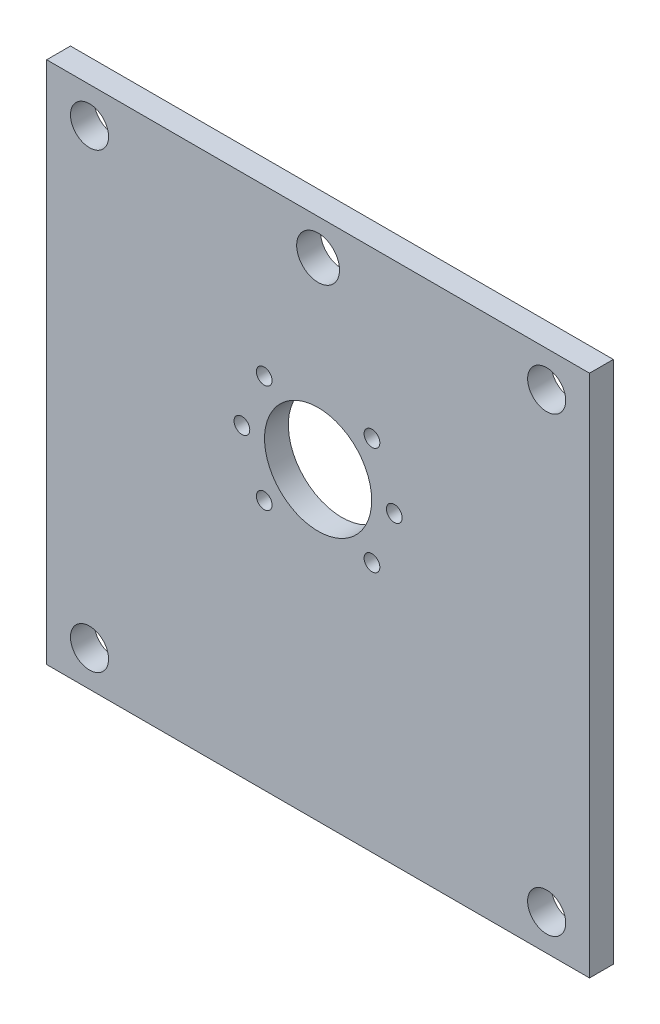
from build123d import *

# Parameters (mm, degrees)
SKETCH_1_W               = 114
SKETCH_1_H               = 110
SKETCH_1_R               = 11.25
EXTRUDE_1_DEPTH          = 5
SKETCH_2_R               = 4
CUT_EXTRUDE_1_DEPTH      = 80.366239674
MIRROR_2_COPY_1_SKETCH_R = 4
MIRROR_2_COPY_1_DEPTH    = 80.366239674
HOLE_WIZARD_M4_2_D       = 3.3
HOLE_WIZARD_M4_3_D       = 3.3
HOLE_WIZARD_M4_4_D       = 3.3
SKETCH_3_R               = 4.5
CUT_EXTRUDE_2_DEPTH      = 80.366239674


with BuildPart() as part:
    # 草图1 → 凸台-拉伸1 (new body)
    with BuildSketch(Plane.XY):
        Rectangle(SKETCH_1_W, SKETCH_1_H)
        with Locations((0, 9)):
            Circle(SKETCH_1_R, mode=Mode.SUBTRACT)
    extrude(amount=EXTRUDE_1_DEPTH)

    # 草图2 → 切除-拉伸1 (cut, through all)
    with BuildSketch(Plane.XY.offset(5)):
        with Locations((-48, 47.5)):
            Circle(SKETCH_2_R)
    cut_extrude_1 = extrude(amount=-CUT_EXTRUDE_1_DEPTH, mode=Mode.SUBTRACT)

    # 镜向1: 切除-拉伸1 across plane
    add(cut_extrude_1.mirror(Plane.ZX), mode=Mode.SUBTRACT)

    # 镜向2: 切除-拉伸1 across plane
    add(cut_extrude_1.mirror(Plane(origin=(0, 0, 0), x_dir=(0, 0, 1), z_dir=(1, 0, 0))), mode=Mode.SUBTRACT)

    # 镜向2 copy 1 sketch → 镜向2 copy 1 (cut, through all)
    with BuildSketch(Plane(origin=(0, 0, 5), x_dir=(-1, 0, 0), z_dir=(0, 0, 1))):
        with Locations((-48, 47.5)):
            Circle(MIRROR_2_COPY_1_SKETCH_R)
    extrude(amount=-MIRROR_2_COPY_1_DEPTH, mode=Mode.SUBTRACT)

    # M4 螺纹孔的螺纹孔钻头2 (through all)
    with Locations(Plane(origin=(-16, 9, 5), x_dir=(1, 0, 0), z_dir=(0, 0, 1))):
        with Locations((0, 0)):
            Hole(HOLE_WIZARD_M4_2_D / 2)

    # M4 螺纹孔的螺纹孔钻头3 (through all)
    with Locations(Plane(origin=(-11.313708499, 20.313708499, 5), x_dir=(1, 0, 0), z_dir=(0, 0, 1))):
        with Locations((0, 0), (0, -22.627416998)):
            Hole(HOLE_WIZARD_M4_3_D / 2)

    # M4 螺纹孔的螺纹孔钻头4 (through all)
    with Locations(Plane(origin=(11.313708499, 20.313708499, 5), x_dir=(1, 0, 0), z_dir=(0, 0, 1))):
        with Locations((0, 0), (4.686291501, -11.313708499), (0, -22.627416998)):
            Hole(HOLE_WIZARD_M4_4_D / 2)

    # 草图3 → 切除-拉伸2 (cut, through all)
    with BuildSketch(Plane.XY.offset(5)):
        with Locations((0, 47.5)):
            Circle(SKETCH_3_R)
    extrude(amount=-CUT_EXTRUDE_2_DEPTH, mode=Mode.SUBTRACT)


solid = part.part
